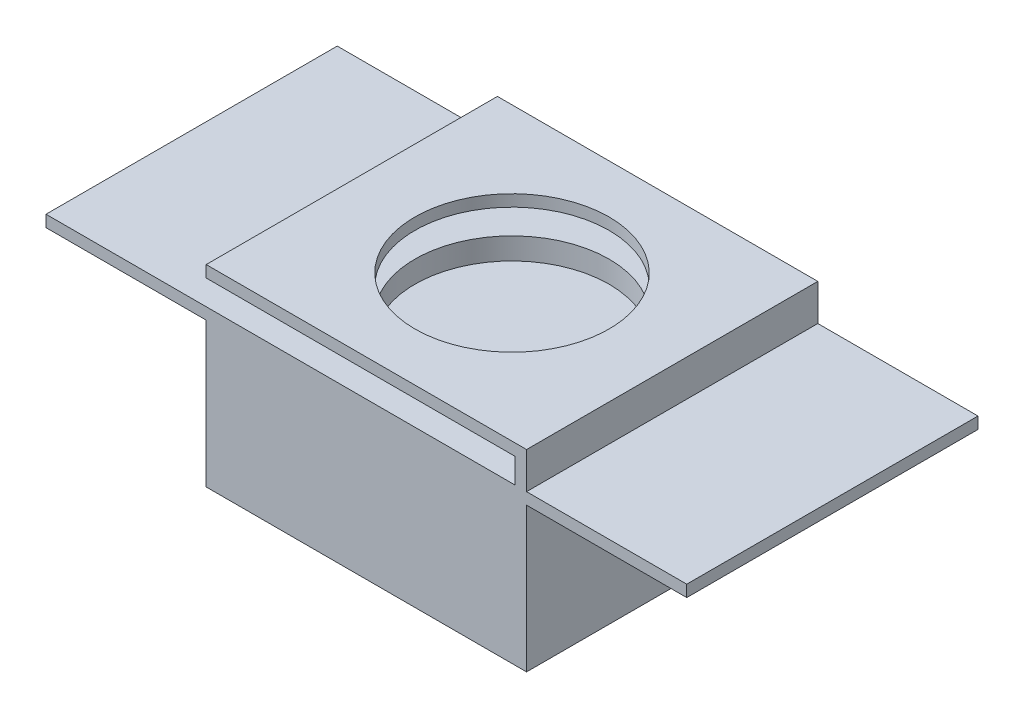
from build123d import *

# Parameters (mm, degrees)
BOSS_EXTRUDE1_DEPTH = 31.75
SKETCH2_R           = 10.583333333
CUT_EXTRUDE1_DEPTH  = 6.35


with BuildPart() as part:
    # Sketch1 → Boss-Extrude1 (new body)
    with BuildSketch(Plane.XY):
        Polygon((-17.4625, 0), (17.4625, 0), (17.4625, 15.748), (34.925, 15.748), (34.925, 17.018), (17.4625, 17.018), (17.4625, 20.997333333), (-17.4625, 20.997333333), (-17.4625, 19.727333333), (16.1925, 19.727333333), (16.1925, 17.018), (-17.4625, 17.018), (-34.925, 17.018), (-34.925, 15.748), (-17.4625, 15.748), align=None)
    extrude(amount=BOSS_EXTRUDE1_DEPTH)

    # Sketch2 → Cut-Extrude1 (cut)
    with BuildSketch(Plane(origin=(0, 20.997333333, 0), x_dir=(1, 0, 0), z_dir=(0, 1, 0))):
        with Locations(Location((0, -15.875, 0), (0, 0, 270))):
            Circle(SKETCH2_R)
    extrude(amount=-CUT_EXTRUDE1_DEPTH, mode=Mode.SUBTRACT)


solid = part.part
